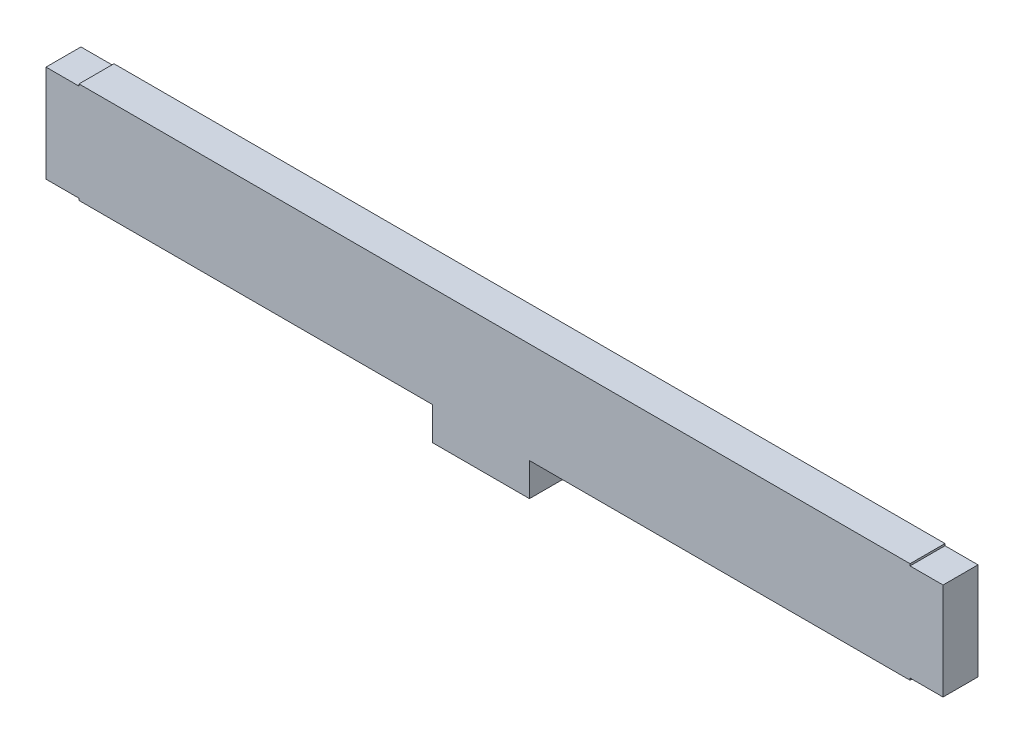
from build123d import *

# Parameters (mm, degrees)
BOSS_EXTRUDE1_DEPTH = 18


with BuildPart() as part:
    # Sketch1 → Boss-Extrude1 (new body)
    with BuildSketch(Plane.XY):
        Polygon((0, 0), (428, 0), (428, -1), (445, -1), (445, -51), (428, -51), (428, -52), (232, -52), (232, -69), (182, -69), (182, -52), (0, -52), (0, -51), (-17, -51), (-17, -1), (0, -1), align=None)
    extrude(amount=BOSS_EXTRUDE1_DEPTH)


solid = part.part
